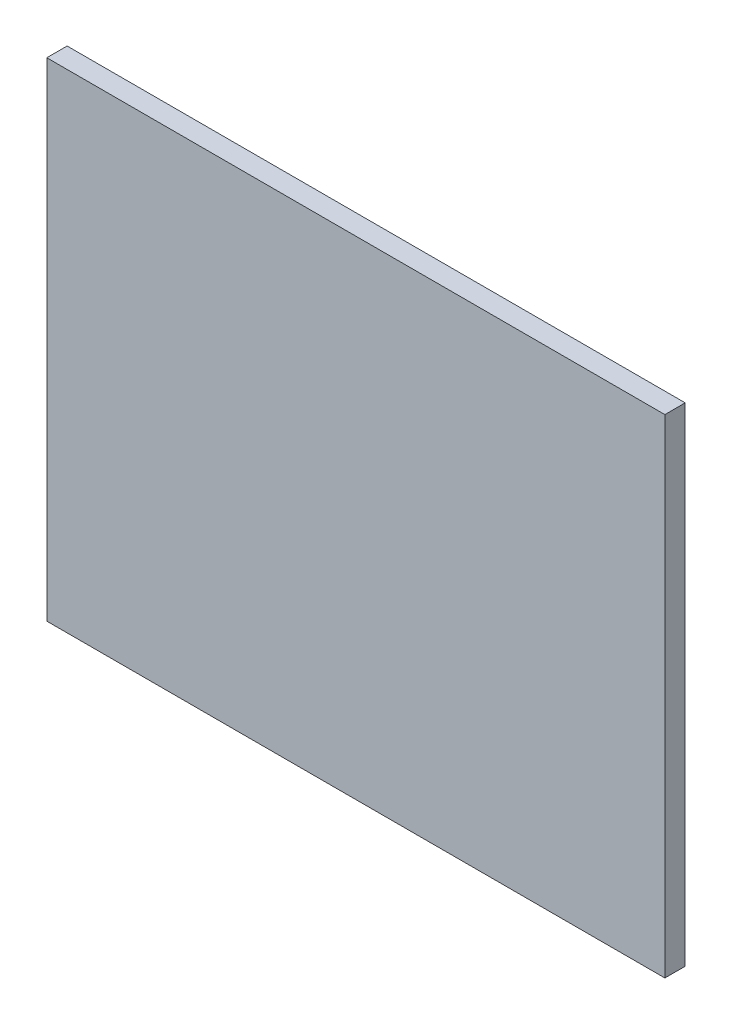
from build123d import *

# Parameters (mm, degrees)
SKETCH_1_W      = 76
SKETCH_1_H      = 60
EXTRUDE_1_DEPTH = 2.5


with BuildPart() as part:
    # 草图1 → 凸台-拉伸1 (new body)
    with BuildSketch(Plane.XY):
        with Locations((38, -30)):
            Rectangle(SKETCH_1_W, SKETCH_1_H)
    extrude(amount=EXTRUDE_1_DEPTH)


solid = part.part
